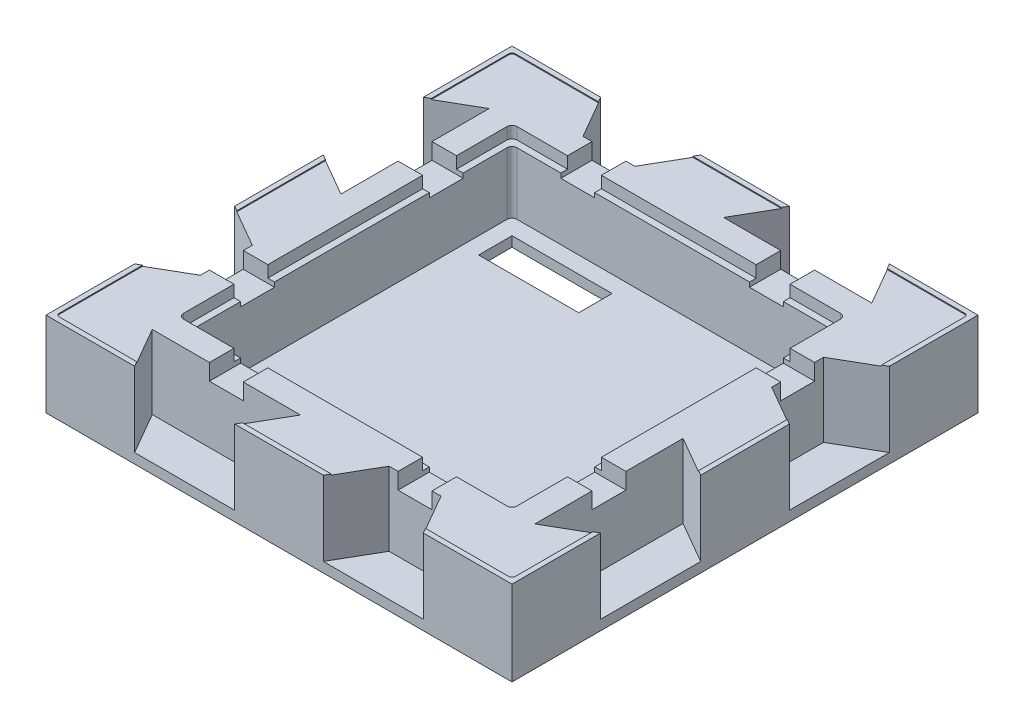
from build123d import *

# Parameters (mm, degrees)
SKETCH1_W           = 139.7
SKETCH1_H           = 139.7
BOSS_EXTRUDE1_DEPTH = 12.7
SKETCH2_W           = 136.7
SKETCH2_H           = 136.7
CUT_EXTRUDE1_DEPTH  = 0.3
CUT_EXTRUDE2_START  = -22.4
CUT_EXTRUDE2_DEPTH  = 125.396102867
SKETCH18_W          = 10.16
SKETCH18_H          = 4.875
CUT_EXTRUDE6_DEPTH  = 20
FILLET1_R           = 1
CIRPATTERN1_COUNT   = 4
SKETCH19_W          = 100
SKETCH19_H          = 100
CUT_EXTRUDE8_DEPTH  = 3.5
SKETCH20_W          = 96
SKETCH20_H          = 96
CUT_EXTRUDE9_DEPTH  = 18.6
SKETCH21_W          = 30
SKETCH21_H          = 10
CUT_EXTRUDE10_DEPTH = 102.290695525
FILLET2_R           = 1.5


with BuildPart() as part:
    # Sketch1 → Boss-Extrude1 (new, symmetric)
    with BuildSketch(Plane(origin=(0, 0, 0), x_dir=(1, 0, 0), z_dir=(0, 1, 0))):
        Rectangle(SKETCH1_W, SKETCH1_H)
    extrude(amount=BOSS_EXTRUDE1_DEPTH, both=True)

    # Sketch2 → Cut-Extrude1 (cut)
    with BuildSketch(Plane(origin=(0, 12.7, 0), x_dir=(1, 0, 0), z_dir=(0, 1, 0))):
        Rectangle(SKETCH2_W, SKETCH2_H)
    extrude(amount=-CUT_EXTRUDE1_DEPTH, mode=Mode.SUBTRACT)

    # Sketch4 → Cut-Extrude2 (cut)
    with BuildSketch(Plane(origin=(0, 12.7, 0), x_dir=(1, 0, 0), z_dir=(0, 1, 0)).offset(CUT_EXTRUDE2_START)):
        Polygon((-43.283333333, -69.85), (-50.500211698, -57.35), (-6.066454968, -57.35), (-13.283333333, -69.85), align=None)
        Polygon((43.283333333, -69.85), (36.066454968, -57.35), (20.500211698, -57.35), (13.283333333, -69.85), align=None)
    cut_extrude2 = extrude(amount=CUT_EXTRUDE2_DEPTH, mode=Mode.SUBTRACT)

    # Sketch18 → Cut-Extrude6 (cut)
    with BuildSketch(Plane.XY.offset(57.35)):
        with Locations((28.283333333, 9.9625)):
            Rectangle(SKETCH18_W, SKETCH18_H)
        with Locations((-28.283333333, 9.9625)):
            Rectangle(SKETCH18_W, SKETCH18_H)
    cut_extrude6 = extrude(amount=-CUT_EXTRUDE6_DEPTH, mode=Mode.SUBTRACT)

    # Fillet1
    fillet1_edges = [part.edges().sort_by_distance(p)[0] for p in [
        (-68.35, 12.55, -68.35),
        (-68.35, 12.55, 68.35),
        (68.35, 12.55, 68.35),
        (68.35, 12.55, -68.35),
    ]]
    fillet(fillet1_edges, radius=FILLET1_R)

    # CirPattern1: Cut-Extrude2, Cut-Extrude6 ×4 about axis
    cirpattern1_axis = Axis((0, 0, 0), (0, 1, 0))
    add([cut_extrude2.rotate(cirpattern1_axis, i * 360 / CIRPATTERN1_COUNT) for i in range(1, CIRPATTERN1_COUNT)], mode=Mode.SUBTRACT)
    add([cut_extrude6.rotate(cirpattern1_axis, i * 360 / CIRPATTERN1_COUNT) for i in range(1, CIRPATTERN1_COUNT)], mode=Mode.SUBTRACT)

    # Sketch19 → Cut-Extrude8 (cut)
    with BuildSketch(Plane(origin=(0, 12.4, 0), x_dir=(1, 0, 0), z_dir=(0, 1, 0))):
        Rectangle(SKETCH19_W, SKETCH19_H)
    extrude(amount=-CUT_EXTRUDE8_DEPTH, mode=Mode.SUBTRACT)

    # Sketch20 → Cut-Extrude9 (cut)
    with BuildSketch(Plane(origin=(0, 8.9, 0), x_dir=(1, 0, 0), z_dir=(0, 1, 0))):
        Rectangle(SKETCH20_W, SKETCH20_H)
    extrude(amount=-CUT_EXTRUDE9_DEPTH, mode=Mode.SUBTRACT)

    # Sketch21 → Cut-Extrude10 (cut, through all)
    with BuildSketch(Plane(origin=(0, -9.7, 0), x_dir=(1, 0, 0), z_dir=(0, 1, 0))):
        with Locations((-28, 38)):
            Rectangle(SKETCH21_W, SKETCH21_H)
    extrude(amount=-CUT_EXTRUDE10_DEPTH, mode=Mode.SUBTRACT)

    # Fillet2
    fillet2_edges = [part.edges().sort_by_distance(p)[0] for p in [
        (50, 10.65, 50),
        (-50, 10.65, -50),
        (-50, 10.65, 50),
        (50, 10.65, -50),
        (48, -0.4, -48),
        (48, -0.4, 48),
        (-48, -0.4, 48),
        (-48, -0.4, -48),
    ]]
    fillet(fillet2_edges, radius=FILLET2_R)


solid = part.part
